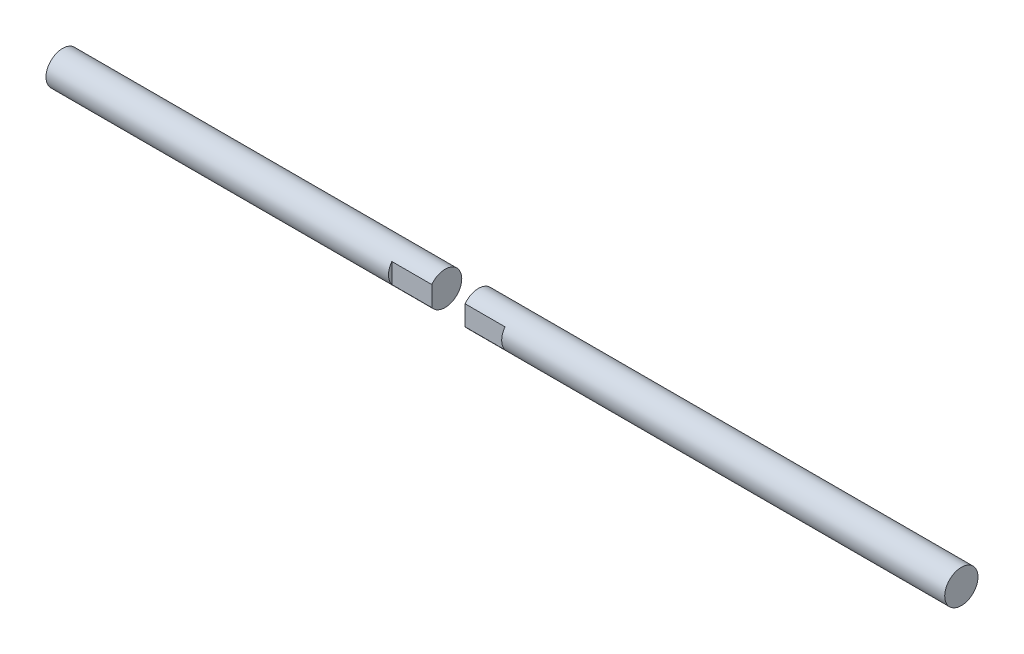
from build123d import *

# Parameters (mm, degrees)
SKETCH1_R               = 3.175
BOSS_EXTRUDE1_DEPTH     = 165.1
CUT_EXTRUDE1_DEPTH      = 166.161046406
CUT_EXTRUDE1_DEPTH_BACK = 166.161046406
SKETCH2_W               = 6.35
SKETCH2_H               = 14.816322072
SKETCH3_W               = 21.59
SKETCH3_H               = 10.879828445
CUT_EXTRUDE2_DEPTH      = 12.954
SKETCH4_R               = 3.175
BOSS_EXTRUDE2_DEPTH     = 6.35


with BuildPart() as part:
    # Sketch1 → Boss-Extrude1 (new body)
    with BuildSketch(Plane(origin=(0, 0, 0), x_dir=(0, 0, -1), z_dir=(1, 0, 0))):
        Circle(SKETCH1_R)
    extrude(amount=BOSS_EXTRUDE1_DEPTH)

    # Sketch2 → Cut-Extrude1 (cut, two sides: drawn at the far end of the back side and taken through both)
    with BuildSketch(Plane.XY.offset(-CUT_EXTRUDE1_DEPTH_BACK)):
        with Locations((76.139978718, 0.386933618)):
            Rectangle(SKETCH2_W, SKETCH2_H)
    extrude(amount=CUT_EXTRUDE1_DEPTH + CUT_EXTRUDE1_DEPTH_BACK, mode=Mode.SUBTRACT)


with BuildPart() as cut_extrude1_piece_1:
    # of the separate pieces the step leaves, piece 1, a body of its own (cut_extrude1_pieces)
    add(part.part.solids().sort_by_distance((79.314978718, 0, -3.175))[0])


with BuildPart() as cut_extrude1_piece_2:
    # of the separate pieces the step leaves, piece 2, a body of its own (cut_extrude1_pieces)
    add(part.part.solids().sort_by_distance((0, 0, -3.175))[0])


with BuildPart() as cut_extrude2_tool:
    # Sketch3 → Cut-Extrude2 (new body)
    with BuildSketch(Plane.XY.offset(2.54)):
        with Locations((76.139978718, 0.388956266)):
            Rectangle(SKETCH3_W, SKETCH3_H)
    extrude(amount=CUT_EXTRUDE2_DEPTH)


with BuildPart() as cut_extrude1_piece_1_1:
    add(cut_extrude1_piece_1.part)

    # Cut-Extrude2: cut by cut_extrude2_tool
    add(cut_extrude2_tool.part, mode=Mode.SUBTRACT)

    # Sketch4 → Boss-Extrude2 (add)
    with BuildSketch(Plane(origin=(165.1, 0, 0), x_dir=(0, 0, -1), z_dir=(1, 0, 0))):
        with Locations(Location((0, 0, 0), (0, 0, 143.130102354))):
            Circle(SKETCH4_R)
    extrude(amount=BOSS_EXTRUDE2_DEPTH)


with BuildPart() as cut_extrude1_piece_2_1:
    add(cut_extrude1_piece_2.part)

    # Cut-Extrude2: cut by cut_extrude2_tool
    add(cut_extrude2_tool.part, mode=Mode.SUBTRACT)


solid = Compound([cut_extrude1_piece_1_1.part, cut_extrude1_piece_2_1.part])
